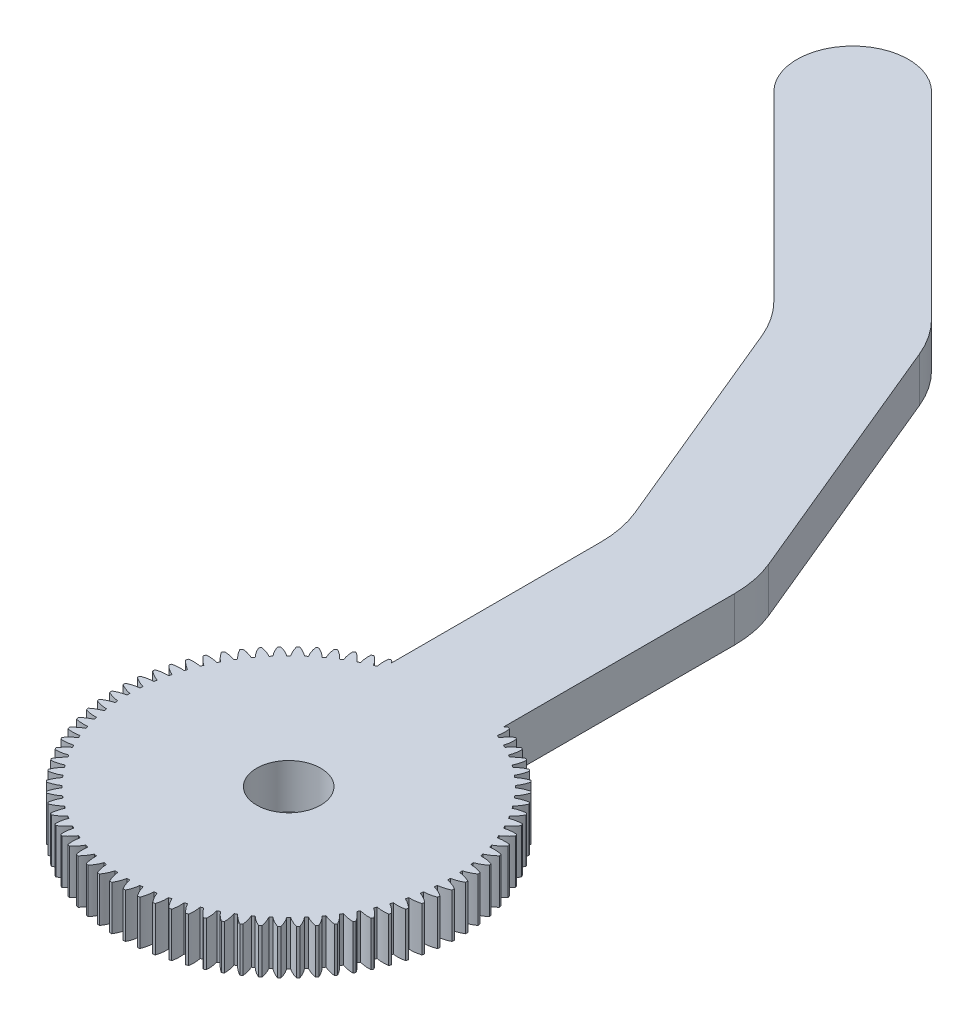
from build123d import *

# Parameters (mm, degrees)
SKETCH1_R           = 15.375
SKETCH1_R_2         = 2.875
BOSS_EXTRUDE1_DEPTH = 4
CUT_EXTRUDE1_DEPTH  = 23.108397726
CIRPATTERN1_COUNT   = 80
BOSS_EXTRUDE2_DEPTH = 4


with BuildPart() as part:
    # Sketch1 → Boss-Extrude1 (new body)
    with BuildSketch(Plane(origin=(0, 0, 0), x_dir=(1, 0, 0), z_dir=(0, 1, 0))):
        with Locations(Location((0, 0, 0), (0, 0, 270))):
            Circle(SKETCH1_R)
        with Locations(Location((0, 0, 0), (0, 0, 270))):
            Circle(SKETCH1_R_2, mode=Mode.SUBTRACT)
    extrude(amount=BOSS_EXTRUDE1_DEPTH)

    # Sketch2 → Cut-Extrude1 (cut, through all)
    with BuildSketch(Plane(origin=(0, 4, 0), x_dir=(1, 0, 0), z_dir=(0, 1, 0))):
        with BuildLine():
            Line((0, 15.375), (0, 14.375))
            ThreePointArc((0, 14.375), (0.062500591, 14.374864127), (0.125, 14.374456511))
            ThreePointArc((0.125, 14.374456511), (0.268283015, 14.887370303), (0.5, 15.366867768))
            ThreePointArc((0.5, 15.366867768), (0.250033064, 15.372966808), (0, 15.375))
        make_face()
        with BuildLine():
            ThreePointArc((-0.125, 14.374456511), (-0.062500591, 14.374864127), (0, 14.375))
            Line((0, 14.375), (0, 15.375))
            ThreePointArc((0, 15.375), (-0.250033064, 15.372966808), (-0.5, 15.366867768))
            ThreePointArc((-0.5, 15.366867768), (-0.268283015, 14.887370303), (-0.125, 14.374456511))
        make_face()
    cut_extrude1 = extrude(amount=-CUT_EXTRUDE1_DEPTH, mode=Mode.SUBTRACT)

    # CirPattern1: Cut-Extrude1 ×80 about axis
    cirpattern1_axis = Axis((0, 0, 0), (0, 1, 0))
    for i in range(1, CIRPATTERN1_COUNT):
        add(cut_extrude1.rotate(cirpattern1_axis, i * 360 / CIRPATTERN1_COUNT), mode=Mode.SUBTRACT)

    # Sketch3 → Boss-Extrude2 (add)
    with BuildSketch(Plane(origin=(0, 4, 0), x_dir=(1, 0, 0), z_dir=(0, 1, 0))):
        with BuildLine():
            Line((5, 10), (-5, 10))
            Line((-5, 10), (-5, 33.010876326))
            ThreePointArc((-5, 33.010876326), (-5.192147196, 34.961779546), (-5.761204675, 36.83771065))
            Line((-5.761204675, 36.83771065), (-13.805881134, 56.259277663))
            ThreePointArc((-13.805881134, 56.259277663), (-14.729980336, 57.988145669), (-15.973608647, 59.503511151))
            Line((-15.973608647, 59.503511151), (-32.244755339, 75.774657842))
            ThreePointArc((-32.244755339, 75.774657842), (-32.244755339, 82.845725654), (-25.173687527, 82.845725654))
            Line((-25.173687527, 82.845725654), (-7.496017997, 65.168056125))
            ThreePointArc((-7.496017997, 65.168056125), (-6.252389686, 63.652690643), (-5.328290484, 61.923822636))
            Line((-5.328290484, 61.923822636), (4.238795325, 38.826834324))
            ThreePointArc((4.238795325, 38.826834324), (4.807852804, 36.95090322), (5, 35))
            Line((5, 35), (5, 10))
        make_face()
    extrude(amount=-BOSS_EXTRUDE2_DEPTH)


solid = part.part
